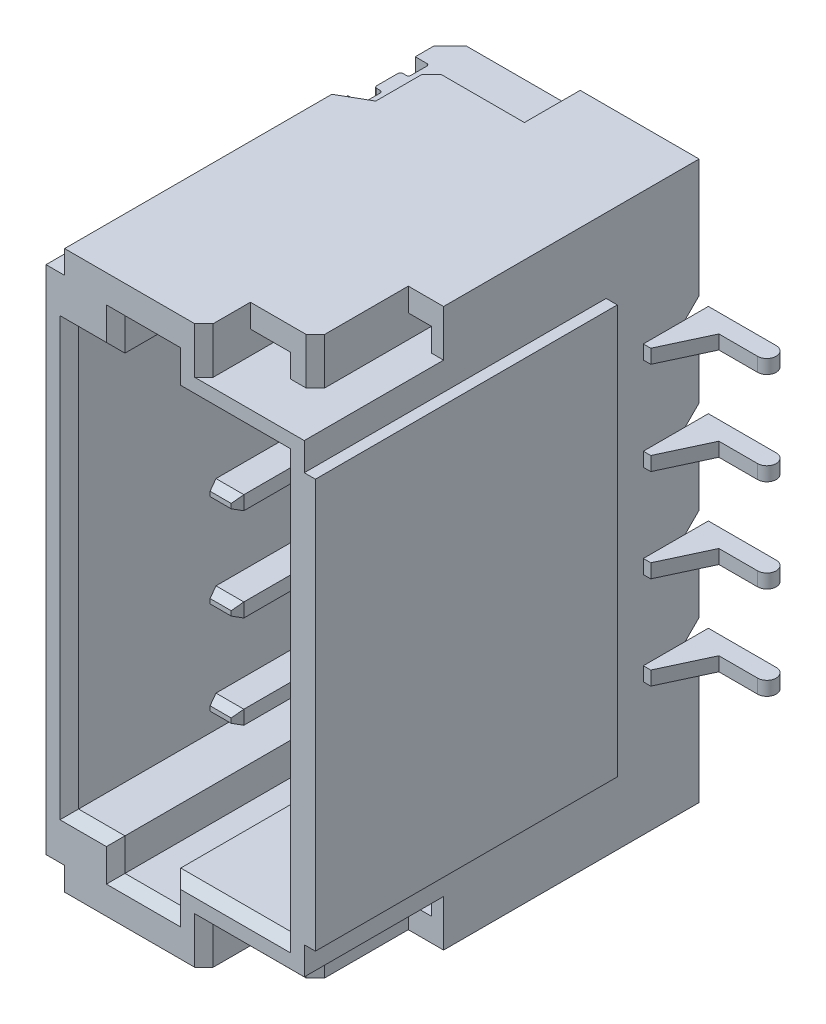
from build123d import *

# Parameters (mm, degrees)
BOSS_EXTRUDE2_START      = -0.815
BOSS_EXTRUDE2_DEPTH      = 0.15
BOSS_EXTRUDE3_START      = 2.26
BOSS_EXTRUDE3_DEPTH      = 0.2
BOSS_EXTRUDE4_START      = 1.76
SKETCH4_W                = 2.899999619
SKETCH4_H                = 6
BOSS_EXTRUDE4_DEPTH      = 4.25
CUT_EXTRUDE2_DEPTH       = 8.723710007
LPATTERN1_COUNT          = 4
LPATTERN1_PITCH          = 1
SKETCH6_OUTSIDE_W        = 7.998
SKETCH6_OUTSIDE_H        = 9.648
SKETCH6_OUTSIDE_W_2      = 3.400752587
SKETCH6_OUTSIDE_H_2      = 4.399999618
CUT_EXTRUDE3_DEPTH       = 0.12
SKETCH7_W                = 2.280000687
SKETCH7_H                = 4.5
CUT_EXTRUDE4_DEPTH       = 3.2
SKETCH8_W                = 0.600000381
SKETCH8_H                = 0.349998474
SKETCH8_H_2              = 0.350000382
CUT_EXTRUDE6_DEPTH       = 2.6
CHAMFER1_SIZE            = 0.1
BOSS_EXTRUDE5_START      = -1.82
BOSS_EXTRUDE5_DEPTH      = 0.15
CHAMFER2_SIZE            = 0.1
CHAMFER2_SIZE2           = 0.05
CHAMFER3_SIZE            = 0.05
CHAMFER3_SIZE2           = 0.1
LPATTERN2_COUNT          = 4
LPATTERN2_PITCH          = 1
SKETCH10_W               = 4.538557702
SKETCH10_H               = 0.25
SKETCH10_W_2             = 4.80487801
CUT_EXTRUDE7_DEPTH       = 0.2
CUT_EXTRUDE8_DEPTH       = 0.5
SKETCH12_W               = 0.600000143
SKETCH12_H               = 0.25
CUT_EXTRUDE9_DEPTH       = 1
CHAMFER4_SIZE            = 0.1
CHAMFER5_SIZE            = 0.1
CHAMFER4_OF_MIRROR1_SIZE = 0.1
CHAMFER5_OF_MIRROR1_SIZE = 0.1
CUT_EXTRUDE10_DEPTH      = 0.5
CHAMFER6_SIZE            = 0.1
SKETCH14_W               = 0.431049877
SKETCH14_H               = 0.25
SKETCH14_W_2             = 0.251151421
CUT_EXTRUDE11_DEPTH      = 2
CHAMFER6_OF_MIRROR3_SIZE = 0.1


with BuildPart() as part:
    # Sketch2 → Boss-Extrude2 (new body)
    with BuildSketch(Plane(origin=(0, 0, 0), x_dir=(1, 0, 0), z_dir=(0, 1, 0)).offset(BOSS_EXTRUDE2_START)):
        with BuildLine():
            Line((22.630613327, -2.360296965), (22.630613327, -1.910297036))
            Line((22.630613327, -1.910297036), (25.410614014, -1.910297036))
            Line((25.410614014, -1.910297036), (25.410614014, -1.660297036))
            Line((25.410614014, -1.660297036), (26.140613556, -1.660297036))
            ThreePointArc((26.140613556, -1.660297036), (26.24061352, -1.760297), (26.140613556, -1.860296965))
            Line((26.140613556, -1.860296965), (25.723766327, -1.860296965))
            Line((25.723766327, -1.860296965), (25.490613937, -2.360296965))
            Line((25.490613937, -2.360296965), (22.630613327, -2.360296965))
        make_face()
    extrude(amount=BOSS_EXTRUDE2_DEPTH)


with BuildPart() as body_2:
    # Body-Move/Copy2: copy of part
    add(part.part.moved(Location((0, -1, 0))))


with BuildPart() as body_3:
    # Body-Move/Copy3: copy of part
    add(part.part.moved(Location((0, 1, 0))))


with BuildPart() as body_4:
    # Body-Move/Copy4: copy of body 3
    add(body_3.part.moved(Location((0, 1, 0))))


with BuildPart() as body_5:
    # Sketch3 → Boss-Extrude3 (new body)
    with BuildSketch(Plane(origin=(0, 0, 0), x_dir=(1, 0, 0), z_dir=(0, 1, 0)).offset(BOSS_EXTRUDE3_START)):
        with BuildLine():
            Line((22.730613708, -2.960297108), (24.130613327, -2.960297108))
            Line((24.130613327, -2.960297108), (24.130613327, -1.835296988))
            Line((24.130613327, -1.835296988), (23.955612183, -1.660297036))
            Line((23.955612183, -1.660297036), (22.805612564, -1.660297036))
            Line((22.805612564, -1.660297036), (22.630613327, -1.835296988))
            Line((22.630613327, -1.835296988), (22.630613327, -2.035296917))
            Line((22.630613327, -2.035296917), (22.755613327, -2.035296917))
            ThreePointArc((22.755613327, -2.035296917), (22.773290756, -2.042619444), (22.780612946, -2.060297012))
            Line((22.780612946, -2.060297012), (22.780612946, -2.232796907))
            ThreePointArc((22.780612946, -2.232796907), (22.773287217, -2.250482782), (22.755601342, -2.257808511))
            Line((22.755601342, -2.257808511), (22.718101914, -2.257808511))
            ThreePointArc((22.718101914, -2.257808511), (22.700432315, -2.265127499), (22.693113327, -2.282797098))
            Line((22.693113327, -2.282797098), (22.693113327, -2.512797117))
            ThreePointArc((22.693113327, -2.512797117), (22.700435531, -2.530474601), (22.718112946, -2.537796974))
            Line((22.718112946, -2.537796974), (22.755613327, -2.537796974))
            ThreePointArc((22.755613327, -2.537796974), (22.773290895, -2.545119362), (22.780612946, -2.56279707))
            Line((22.780612946, -2.56279707), (22.780612946, -2.735296965))
            ThreePointArc((22.780612946, -2.735296965), (22.773290756, -2.752974533), (22.755613327, -2.76029706))
            Line((22.755613327, -2.76029706), (22.630613327, -2.76029706))
            Line((22.630613327, -2.76029706), (22.630613327, -2.860296965))
            Line((22.630613327, -2.860296965), (22.730613708, -2.960297108))
        make_face()
    extrude(amount=BOSS_EXTRUDE3_DEPTH)


with BuildPart() as body_6:
    # Sketch4 → Boss-Extrude4 (new body)
    with BuildSketch(Plane.XY.offset(BOSS_EXTRUDE4_START)):
        with Locations((24.080613137, -0.240909576)):
            Rectangle(SKETCH4_W, SKETCH4_H)
    extrude(amount=BOSS_EXTRUDE4_DEPTH)

    # Sketch5 → Cut-Extrude2 (cut, through all)
    with BuildSketch(Plane.ZY.offset(-22.630613327)):
        Polygon((1.760296941, 1.484088898), (1.910297036, 1.334089279), (2.360296965, 1.334089279), (2.360296965, 1.184089661), (1.910297036, 1.184089661), (1.760296941, 1.034090042), (1.752676685, 1.034090042), (1.752676685, 1.484088898), align=None)
    cut_extrude2 = extrude(amount=-CUT_EXTRUDE2_DEPTH, mode=Mode.SUBTRACT)

    # LPattern1: Cut-Extrude2 ×4
    with Locations(*[(0, -i * LPATTERN1_PITCH, 0) for i in range(1, LPATTERN1_COUNT)]):
        add(cut_extrude2, mode=Mode.SUBTRACT)

    # Sketch6 outside → Cut-Extrude3 (cut)
    with BuildSketch(Plane(origin=(25.530612946, 0, 0), x_dir=(0, 0, -1), z_dir=(1, 0, 0))):
        with Locations((-3.835, -0.241)):
            Rectangle(SKETCH6_OUTSIDE_W, SKETCH6_OUTSIDE_H)
        with Locations((-4.460673354, -0.24091053)):
            Rectangle(SKETCH6_OUTSIDE_W_2, SKETCH6_OUTSIDE_H_2, mode=Mode.SUBTRACT)
    extrude(amount=-CUT_EXTRUDE3_DEPTH, mode=Mode.SUBTRACT)

    # Sketch7 → Cut-Extrude4 (cut)
    with BuildSketch(Plane.XY.offset(6.01)):
        with Locations((24.020613671, -0.240909576)):
            Rectangle(SKETCH7_W, SKETCH7_H)
    extrude(amount=-CUT_EXTRUDE4_DEPTH, mode=Mode.SUBTRACT)

    # Sketch8 → Cut-Extrude6 (cut)
    with BuildSketch(Plane.XY.offset(6.01)):
        with Locations((23.680613517, 2.184089661)):
            Rectangle(SKETCH8_W, SKETCH8_H)
        with Locations((23.680613517, -2.665909767)):
            Rectangle(SKETCH8_W, SKETCH8_H_2)
    extrude(amount=-CUT_EXTRUDE6_DEPTH, mode=Mode.SUBTRACT)

    # Chamfer1
    chamfer1_edges = [body_6.edges().sort_by_distance(p)[0] for p in [
        (22.880613327, -0.240909576, 6.01),
        (23.130613327, -2.490909576, 6.01),
        (25.160614014, -0.240909576, 6.01),
        (24.570613861, 2.009090424, 6.01),
        (24.570613861, -2.490909576, 6.01),
        (23.130613327, 2.009090424, 6.01),
        (23.380613327, 2.184089661, 6.01),
        (23.980613708, 2.184089661, 6.01),
        (23.680613518, 2.359088898, 6.01),
        (23.380613327, -2.665909767, 6.01),
        (23.680613518, -2.840909958, 6.01),
        (23.980613708, -2.665909767, 6.01),
    ]]
    chamfer(chamfer1_edges, length=CHAMFER1_SIZE)

    # Sketch10 → Cut-Extrude7 (cut)
    with BuildSketch(Plane.ZY.offset(-22.630613327)):
        with Locations((3.741017971, 2.634090424)):
            Rectangle(SKETCH10_W, SKETCH10_H)
        with Locations((3.607857817, -3.115909576)):
            Rectangle(SKETCH10_W_2, SKETCH10_H)
    extrude(amount=-CUT_EXTRUDE7_DEPTH, mode=Mode.SUBTRACT)

    # Sketch11 → Cut-Extrude8 (cut)
    with BuildSketch(Plane.XZ.offset(3.240909576)):
        Polygon((22.630613327, 3.248971939), (23.130613327, 2.960297108), (23.130613327, 2.360296965), (24.130613327, 2.360296965), (24.130613327, 1.643555377), (22.630613327, 1.643555377), align=None)
    cut_extrude8 = extrude(amount=-CUT_EXTRUDE8_DEPTH, mode=Mode.SUBTRACT)

    # Sketch12 → Cut-Extrude9 (cut)
    with BuildSketch(Plane.ZY.offset(-23.130613327)):
        with Locations((2.660297037, -2.865909576)):
            Rectangle(SKETCH12_W, SKETCH12_H)
    cut_extrude9 = extrude(amount=-CUT_EXTRUDE9_DEPTH, mode=Mode.SUBTRACT)

    # Chamfer4
    chamfer4_edges = [body_6.edges().sort_by_distance(p)[0] for p in [
        (22.630613327, -2.740909576, 2.50448597),
    ]]
    chamfer(chamfer4_edges, length=CHAMFER4_SIZE)

    # Chamfer5
    chamfer5_edges = [body_6.edges().sort_by_distance(p)[0] for p in [
        (23.130613327, -3.115909576, 2.360296965),
    ]]
    chamfer(chamfer5_edges, length=CHAMFER5_SIZE)

    # Mirror1: Cut-Extrude8, Cut-Extrude9 across plane
    add(cut_extrude8.mirror(Plane(origin=(0, -0.240909576, 0), x_dir=(0, 0, 1), z_dir=(0, -1, 0))), mode=Mode.SUBTRACT)
    add(cut_extrude9.mirror(Plane(origin=(0, -0.240909576, 0), x_dir=(0, 0, 1), z_dir=(0, -1, 0))), mode=Mode.SUBTRACT)

    # Chamfer4 of Mirror1
    chamfer4_of_mirror1_edges = [body_6.edges().sort_by_distance(p)[0] for p in [
        (22.630613327, 2.259090424, 2.50448597),
    ]]
    chamfer(chamfer4_of_mirror1_edges, length=CHAMFER4_OF_MIRROR1_SIZE)

    # Chamfer5 of Mirror1
    chamfer5_of_mirror1_edges = [body_6.edges().sort_by_distance(p)[0] for p in [
        (23.130613327, 2.634090424, 2.360296965),
    ]]
    chamfer(chamfer5_of_mirror1_edges, length=CHAMFER5_OF_MIRROR1_SIZE)

    # Sketch13 → Cut-Extrude10 (cut)
    with BuildSketch(Plane.XZ.offset(3.240909576)):
        Polygon((24.330612183, 5.510296822), (24.330612183, 6.069555527), (25.671033585, 6.069555527), (25.671033585, 4.510296822), (25.030612946, 4.510296822), (25.030612946, 5.510296822), align=None)
    cut_extrude10 = extrude(amount=-CUT_EXTRUDE10_DEPTH, mode=Mode.SUBTRACT)

    # Chamfer6
    chamfer6_edges = [body_6.edges().sort_by_distance(p)[0] for p in [
        (24.330612183, -2.990909576, 6.01),
        (25.030612946, -2.990909576, 5.510296822),
    ]]
    chamfer(chamfer6_edges, length=CHAMFER6_SIZE)

    # Sketch14 → Cut-Extrude11 (cut)
    with BuildSketch(Plane.XY.offset(5.510296822)):
        with Locations((24.546137122, -2.865909576)):
            Rectangle(SKETCH14_W, SKETCH14_H)
        with Locations((25.156188656, -2.865909576)):
            Rectangle(SKETCH14_W_2, SKETCH14_H)
    cut_extrude11 = extrude(amount=-CUT_EXTRUDE11_DEPTH, mode=Mode.SUBTRACT)

    # Mirror3: Cut-Extrude10, Cut-Extrude11 across plane
    add(cut_extrude10.mirror(Plane(origin=(0, -0.240909576, 0), x_dir=(0, 0, 1), z_dir=(0, -1, 0))), mode=Mode.SUBTRACT)
    add(cut_extrude11.mirror(Plane(origin=(0, -0.240909576, 0), x_dir=(0, 0, 1), z_dir=(0, -1, 0))), mode=Mode.SUBTRACT)

    # Chamfer6 of Mirror3
    chamfer6_of_mirror3_edges = [body_6.edges().sort_by_distance(p)[0] for p in [
        (24.330612183, 2.509090424, 6.01),
        (25.030612946, 2.509090424, 5.510296822),
    ]]
    chamfer(chamfer6_of_mirror3_edges, length=CHAMFER6_OF_MIRROR3_SIZE)


with BuildPart() as body_7:
    # Sketch9 → Boss-Extrude5 (new body)
    with BuildSketch(Plane(origin=(0, 0, 0), x_dir=(1, 0, 0), z_dir=(0, 1, 0)).offset(BOSS_EXTRUDE5_START)):
        Polygon((23.360612869, -2.810297012), (23.660614014, -2.810297012), (23.660614014, -4.910296917), (23.62421608, -5.010296822), (23.397010803, -5.010296822), (23.360612869, -4.910296917), align=None)
    extrude(amount=BOSS_EXTRUDE5_DEPTH)

    # Chamfer2
    chamfer2_edges = [body_7.edges().sort_by_distance(p)[0] for p in [
        (23.510613441, -1.82, 5.010296822),
    ]]
    chamfer2_side = [body_7.faces().sort_by_distance(p)[0] for p in [
        (23.510613441, -1.82, 3.90438183),
    ]]
    chamfer(chamfer2_edges, length=CHAMFER2_SIZE, length2=CHAMFER2_SIZE2, reference=chamfer2_side[0])

    # Chamfer3
    chamfer3_edges = [body_7.edges().sort_by_distance(p)[0] for p in [
        (23.510613441, -1.67, 5.010296822),
    ]]
    chamfer3_side = [body_7.faces().sort_by_distance(p)[0] for p in [
        (23.510613441, -1.72, 5.010296822),
    ]]
    chamfer(chamfer3_edges, length=CHAMFER3_SIZE, length2=CHAMFER3_SIZE2, reference=chamfer3_side[0])


with BuildPart() as lpattern2_1:
    # LPattern2: pattern copy
    add(body_7.part.moved(Location(Vector(0, 1, 0) * (1 * LPATTERN2_PITCH))))


with BuildPart() as lpattern2_2:
    # LPattern2: pattern copy
    add(body_7.part.moved(Location(Vector(0, 1, 0) * (2 * LPATTERN2_PITCH))))


with BuildPart() as lpattern2_3:
    # LPattern2: pattern copy
    add(body_7.part.moved(Location(Vector(0, 1, 0) * (3 * LPATTERN2_PITCH))))


with BuildPart() as body_11:
    # Mirror2: mirrored copy
    add(body_5.part.mirror(Plane(origin=(0, -0.240909576, 0), x_dir=(0, 0, 1), z_dir=(0, -1, 0))))


solid = Compound([part.part, body_2.part, body_3.part, body_4.part, body_5.part, body_6.part, body_7.part, lpattern2_1.part, lpattern2_2.part, lpattern2_3.part, body_11.part])
